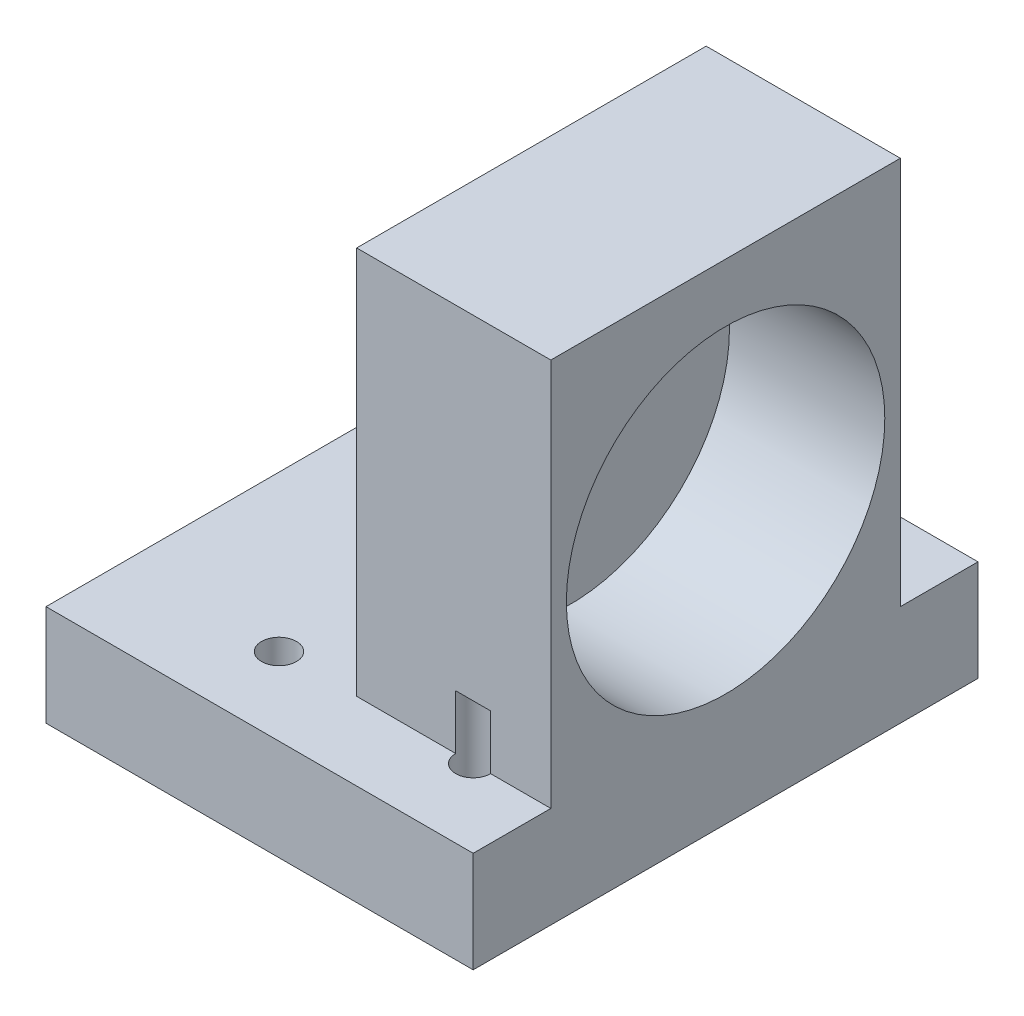
from build123d import *

# Parameters (mm, degrees)
SKETCH1_W           = 55
SKETCH1_H           = 65
BOSS_EXTRUDE1_DEPTH = 13
SKETCH2_W           = 25
SKETCH2_H           = 45
BOSS_EXTRUDE2_DEPTH = 50
SKETCH5_R           = 20.5
CUT_EXTRUDE1_DEPTH  = 20
SKETCH7_R           = 7
CUT_EXTRUDE2_DEPTH  = 20
SKETCH8_R           = 2.25
CUT_EXTRUDE3_DEPTH  = 20
FILLET1_R           = 10


with BuildPart() as part:
    # Sketch1 → Boss-Extrude1 (new body)
    with BuildSketch(Plane(origin=(0, 0, 0), x_dir=(1, 0, 0), z_dir=(0, 1, 0))):
        with Locations((-5, 0)):
            Rectangle(SKETCH1_W, SKETCH1_H)
    extrude(amount=BOSS_EXTRUDE1_DEPTH)

    # Sketch2 → Boss-Extrude2 (add)
    with BuildSketch(Plane(origin=(0, 13, 0), x_dir=(1, 0, 0), z_dir=(0, 1, 0))):
        with Locations((10, 0)):
            Rectangle(SKETCH2_W, SKETCH2_H)
    extrude(amount=BOSS_EXTRUDE2_DEPTH)

    # Sketch5 → Cut-Extrude1 (cut)
    with BuildSketch(Plane(origin=(22.5, 0, 0), x_dir=(0, 0, -1), z_dir=(1, 0, 0))):
        with Locations((0, 35)):
            Circle(SKETCH5_R)
    extrude(amount=-CUT_EXTRUDE1_DEPTH, mode=Mode.SUBTRACT)

    # Sketch7 → Cut-Extrude2 (cut)
    with BuildSketch(Plane(origin=(2.5, 0, 0), x_dir=(0, 0, -1), z_dir=(1, 0, 0))):
        with Locations((0, 35)):
            Circle(SKETCH7_R)
    extrude(amount=-CUT_EXTRUDE2_DEPTH, mode=Mode.SUBTRACT)

    # Sketch8 → Cut-Extrude3 (cut)
    with BuildSketch(Plane(origin=(0, 0, 0), x_dir=(-1, 0, 0), z_dir=(0, -1, 0))):
        with Locations(Location((12.5, -22.5, 0), (0, 0, 90))):
            Circle(SKETCH8_R)
        with Locations(Location((12.5, 22.5, 0), (0, 0, 90))):
            Circle(SKETCH8_R)
        with Locations(Location((-12.5, 22.5, 0), (0, 0, 90))):
            Circle(SKETCH8_R)
        with Locations(Location((-12.5, -22.5, 0), (0, 0, 90))):
            Circle(SKETCH8_R)
    extrude(amount=-CUT_EXTRUDE3_DEPTH, mode=Mode.SUBTRACT)

    # Fillet1
    fillet1_edges = [part.edges().sort_by_distance(p)[0] for p in [
        (-32.5, 6.5, -32.5),
    ]]
    fillet(fillet1_edges, radius=FILLET1_R)


solid = part.part
